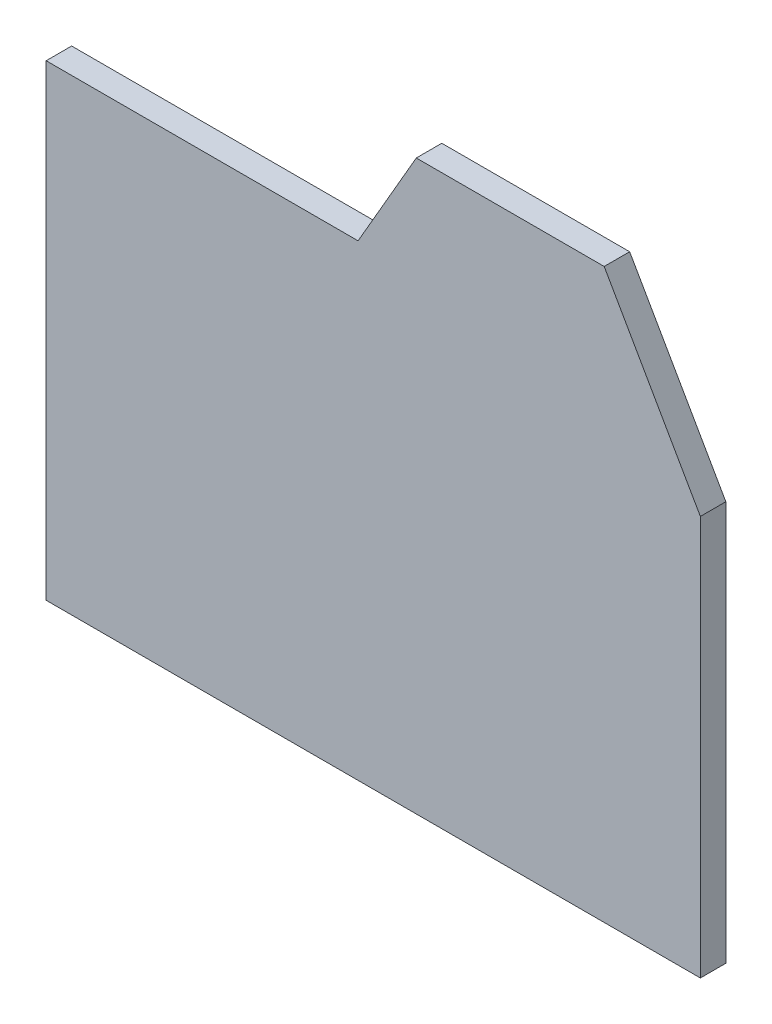
from build123d import *

# Parameters (mm, degrees)
BOSS_EXTRUDE1_DEPTH = 3


with BuildPart() as part:
    # Sketch2 → Boss-Extrude1 (new body)
    with BuildSketch(Plane.XY):
        Polygon((0, 0), (77, 0), (77, 47.04888), (65.6794, 66.86939), (43.56615, 66.86939), (36.71335, 55), (0, 55), align=None)
    extrude(amount=BOSS_EXTRUDE1_DEPTH)


solid = part.part
